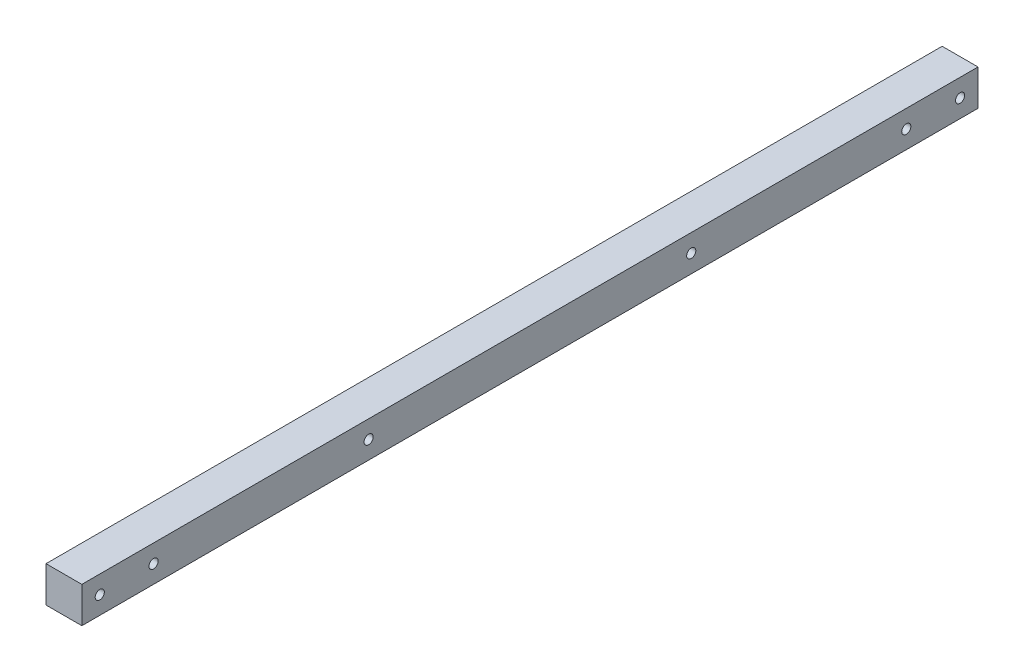
from build123d import *

# Parameters (mm, degrees)
SKETCH_1_W          = 20
SKETCH_1_H          = 20
EXTRUDE_2_DEPTH     = 500
CUT_EXTRUDE_1_REACH = 502.5
SKETCH_2_R          = 2.55
SKETCH_3_W          = 20
SKETCH_3_H          = 50
EXTRUDE_3_DEPTH     = 20
SKETCH_4_R          = 2.55
CUT_EXTRUDE_2_DEPTH = 20
SKETCH_5_W          = 20
SKETCH_5_H          = 20
CUT_EXTRUDE_3_DEPTH = 250
CUT_EXTRUDE_4_REACH = 503.298
SKETCH_6_R          = 2.55
SKETCH_7_W          = 50
SKETCH_7_H          = 20
CUT_EXTRUDE_5_DEPTH = 250
CUT_EXTRUDE_6_REACH = 502.5
SKETCH_8_R          = 2.55


with BuildPart() as part:
    # 草图1 → 凸台-拉伸2 (new body)
    with BuildSketch(Plane.XY):
        Rectangle(SKETCH_1_W, SKETCH_1_H)
    extrude_2 = extrude(amount=EXTRUDE_2_DEPTH)

    # 草图2 → 切除-拉伸1 (cut, up to next)
    with BuildSketch(Plane(origin=(10, 0, 0), x_dir=(0, 0, -1), z_dir=(1, 0, 0)), mode=Mode.PRIVATE) as cut_extrude_1_sk1:
        with Locations((-10, 0)):
            Circle(SKETCH_2_R)
    cut_extrude_1_tool1 = extrude(cut_extrude_1_sk1.sketch, amount=-CUT_EXTRUDE_1_REACH, mode=Mode.PRIVATE) & part.part
    # 草图2 → 切除-拉伸1 (cut, up to next)
    with BuildSketch(Plane(origin=(10, 0, 0), x_dir=(0, 0, -1), z_dir=(1, 0, 0)), mode=Mode.PRIVATE) as cut_extrude_1_sk2:
        with Locations((-40, 0)):
            Circle(SKETCH_2_R)
    cut_extrude_1_tool2 = extrude(cut_extrude_1_sk2.sketch, amount=-CUT_EXTRUDE_1_REACH, mode=Mode.PRIVATE) & part.part
    add(cut_extrude_1_tool1.solids().sort_by_distance((10, 0, 10))[0], mode=Mode.SUBTRACT)
    add(cut_extrude_1_tool2.solids().sort_by_distance((10, 0, 40))[0], mode=Mode.SUBTRACT)

    # 草图3 → 凸台-拉伸3 (add)
    with BuildSketch(Plane.XZ.offset(10)):
        with Locations((0, 25)):
            Rectangle(SKETCH_3_W, SKETCH_3_H)
    extrude_3 = extrude(amount=EXTRUDE_3_DEPTH)

    # 草图4 → 切除-拉伸2 (cut)
    with BuildSketch(Plane(origin=(10, 0, 0), x_dir=(0, 0, -1), z_dir=(1, 0, 0))):
        with Locations((-40, -20)):
            Circle(SKETCH_4_R)
        with Locations((-10, -20)):
            Circle(SKETCH_4_R)
    extrude(amount=-CUT_EXTRUDE_2_DEPTH, mode=Mode.SUBTRACT)

    # 草图5 → 切除-拉伸3 (cut)
    with BuildSketch(Plane.XY.offset(500)):
        Rectangle(SKETCH_5_W, SKETCH_5_H)
    extrude(amount=-CUT_EXTRUDE_3_DEPTH, mode=Mode.SUBTRACT)

    # 镜向2: 凸台-拉伸2, 凸台-拉伸3 across plane
    add(extrude_2.mirror(Plane(origin=(0, 0, 250), x_dir=(1, 0, 0), z_dir=(0, 0, -1))))
    add(extrude_3.mirror(Plane(origin=(0, 0, 250), x_dir=(1, 0, 0), z_dir=(0, 0, -1))))

    # 草图6 → 切除-拉伸4 (cut, up to next)
    with BuildSketch(Plane(origin=(10, 0, 0), x_dir=(0, 0, -1), z_dir=(1, 0, 0)), mode=Mode.PRIVATE) as cut_extrude_4_sk1:
        with Locations((-490, 0)):
            Circle(SKETCH_6_R)
    cut_extrude_4_tool1 = extrude(cut_extrude_4_sk1.sketch, amount=-CUT_EXTRUDE_4_REACH, mode=Mode.PRIVATE) & part.part
    # 草图6 → 切除-拉伸4 (cut, up to next)
    with BuildSketch(Plane(origin=(10, 0, 0), x_dir=(0, 0, -1), z_dir=(1, 0, 0)), mode=Mode.PRIVATE) as cut_extrude_4_sk2:
        with Locations((-460, 0)):
            Circle(SKETCH_6_R)
    cut_extrude_4_tool2 = extrude(cut_extrude_4_sk2.sketch, amount=-CUT_EXTRUDE_4_REACH, mode=Mode.PRIVATE) & part.part
    # 草图6 → 切除-拉伸4 (cut, up to next)
    with BuildSketch(Plane(origin=(10, 0, 0), x_dir=(0, 0, -1), z_dir=(1, 0, 0)), mode=Mode.PRIVATE) as cut_extrude_4_sk3:
        with Locations((-460, -20)):
            Circle(SKETCH_6_R)
    cut_extrude_4_tool3 = extrude(cut_extrude_4_sk3.sketch, amount=-CUT_EXTRUDE_4_REACH, mode=Mode.PRIVATE) & part.part
    # 草图6 → 切除-拉伸4 (cut, up to next)
    with BuildSketch(Plane(origin=(10, 0, 0), x_dir=(0, 0, -1), z_dir=(1, 0, 0)), mode=Mode.PRIVATE) as cut_extrude_4_sk4:
        with Locations((-490, -20)):
            Circle(SKETCH_6_R)
    cut_extrude_4_tool4 = extrude(cut_extrude_4_sk4.sketch, amount=-CUT_EXTRUDE_4_REACH, mode=Mode.PRIVATE) & part.part
    # 草图6 → 切除-拉伸4 (cut, up to next)
    with BuildSketch(Plane(origin=(10, 0, 0), x_dir=(0, 0, -1), z_dir=(1, 0, 0)), mode=Mode.PRIVATE) as cut_extrude_4_sk5:
        with Locations((-10, 0)):
            Circle(SKETCH_6_R)
    cut_extrude_4_tool5 = extrude(cut_extrude_4_sk5.sketch, amount=-CUT_EXTRUDE_4_REACH, mode=Mode.PRIVATE) & part.part
    # 草图6 → 切除-拉伸4 (cut, up to next)
    with BuildSketch(Plane(origin=(10, 0, 0), x_dir=(0, 0, -1), z_dir=(1, 0, 0)), mode=Mode.PRIVATE) as cut_extrude_4_sk6:
        with Locations((-40, 0)):
            Circle(SKETCH_6_R)
    cut_extrude_4_tool6 = extrude(cut_extrude_4_sk6.sketch, amount=-CUT_EXTRUDE_4_REACH, mode=Mode.PRIVATE) & part.part
    add(cut_extrude_4_tool1.solids().sort_by_distance((10, 0, 490))[0], mode=Mode.SUBTRACT)
    add(cut_extrude_4_tool2.solids().sort_by_distance((10, 0, 460))[0], mode=Mode.SUBTRACT)
    add(cut_extrude_4_tool3.solids().sort_by_distance((10, -20, 460))[0], mode=Mode.SUBTRACT)
    add(cut_extrude_4_tool4.solids().sort_by_distance((10, -20, 490))[0], mode=Mode.SUBTRACT)
    add(cut_extrude_4_tool5.solids().sort_by_distance((10, 0, 10))[0], mode=Mode.SUBTRACT)
    add(cut_extrude_4_tool6.solids().sort_by_distance((10, 0, 40))[0], mode=Mode.SUBTRACT)

    # 草图7 → 切除-拉伸5 (cut)
    with BuildSketch(Plane(origin=(10, 0, 0), x_dir=(0, 0, -1), z_dir=(1, 0, 0))):
        with Locations((-475, -20)):
            Rectangle(SKETCH_7_W, SKETCH_7_H)
        with Locations((-25, -20)):
            Rectangle(SKETCH_7_W, SKETCH_7_H)
    extrude(amount=-CUT_EXTRUDE_5_DEPTH, mode=Mode.SUBTRACT)

    # 草图8 → 切除-拉伸6 (cut, up to next)
    with BuildSketch(Plane(origin=(10, 0, 0), x_dir=(0, 0, -1), z_dir=(1, 0, 0)), mode=Mode.PRIVATE) as cut_extrude_6_sk1:
        with Locations((-340, 0)):
            Circle(SKETCH_8_R)
    cut_extrude_6_tool1 = extrude(cut_extrude_6_sk1.sketch, amount=-CUT_EXTRUDE_6_REACH, mode=Mode.PRIVATE) & part.part
    # 草图8 → 切除-拉伸6 (cut, up to next)
    with BuildSketch(Plane(origin=(10, 0, 0), x_dir=(0, 0, -1), z_dir=(1, 0, 0)), mode=Mode.PRIVATE) as cut_extrude_6_sk2:
        with Locations((-160, 0)):
            Circle(SKETCH_8_R)
    cut_extrude_6_tool2 = extrude(cut_extrude_6_sk2.sketch, amount=-CUT_EXTRUDE_6_REACH, mode=Mode.PRIVATE) & part.part
    add(cut_extrude_6_tool1.solids().sort_by_distance((10, 0, 340))[0], mode=Mode.SUBTRACT)
    add(cut_extrude_6_tool2.solids().sort_by_distance((10, 0, 160))[0], mode=Mode.SUBTRACT)


solid = part.part
